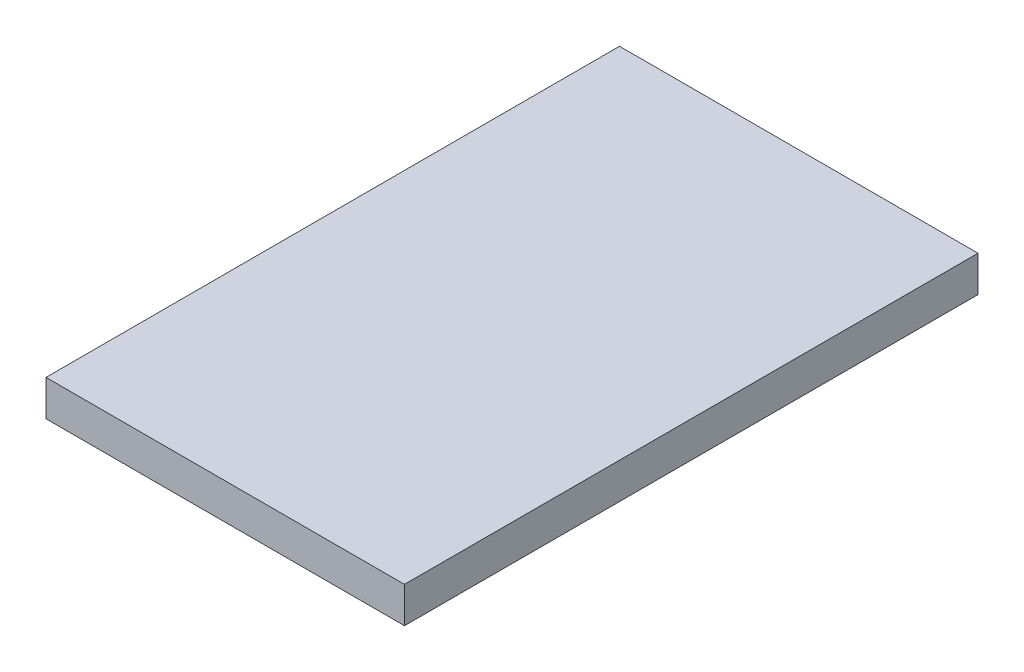
from build123d import *

# Parameters (mm, degrees)
SKETCH1_W           = 50
SKETCH1_H           = 5
BOSS_EXTRUDE1_DEPTH = 80


with BuildPart() as part:
    # Sketch1 → Boss-Extrude1 (new body)
    with BuildSketch(Plane.XY):
        with Locations((25, 2.5)):
            Rectangle(SKETCH1_W, SKETCH1_H)
    extrude(amount=BOSS_EXTRUDE1_DEPTH)


solid = part.part
